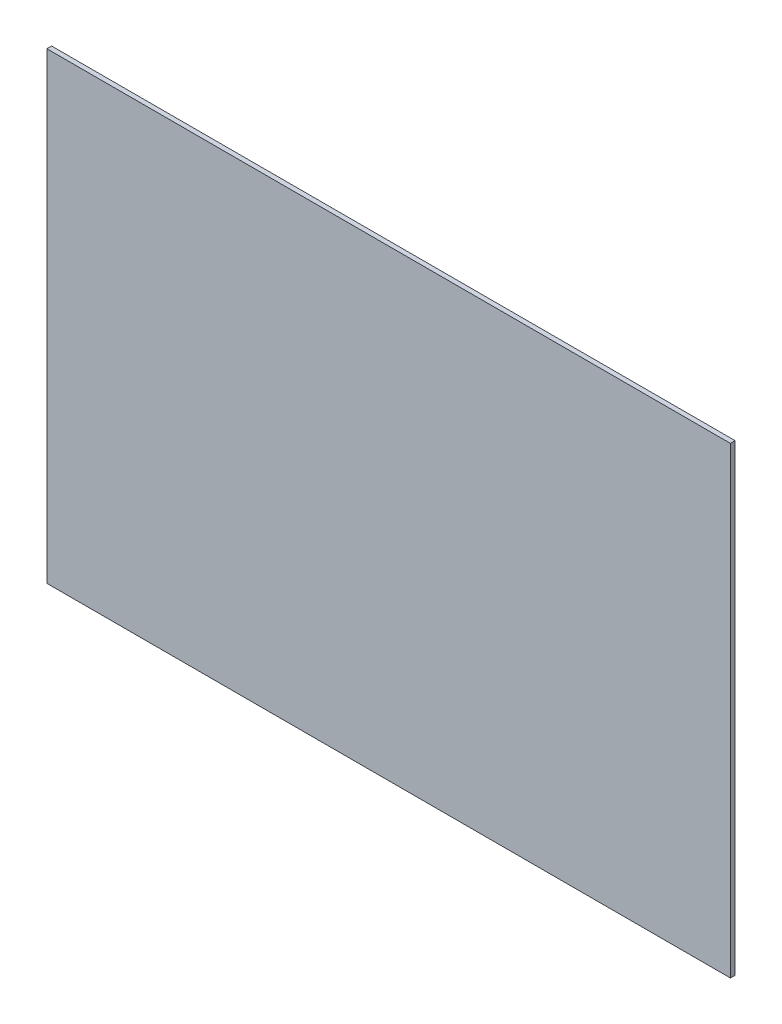
from build123d import *

# Parameters (mm, degrees)
SKETCH1_W           = 459.49
SKETCH1_H           = 311.26
BOSS_EXTRUDE1_DEPTH = 3.175


with BuildPart() as part:
    # Sketch1 → Boss-Extrude1 (new body)
    with BuildSketch(Plane.XY):
        Rectangle(SKETCH1_W, SKETCH1_H)
    extrude(amount=BOSS_EXTRUDE1_DEPTH)


solid = part.part
